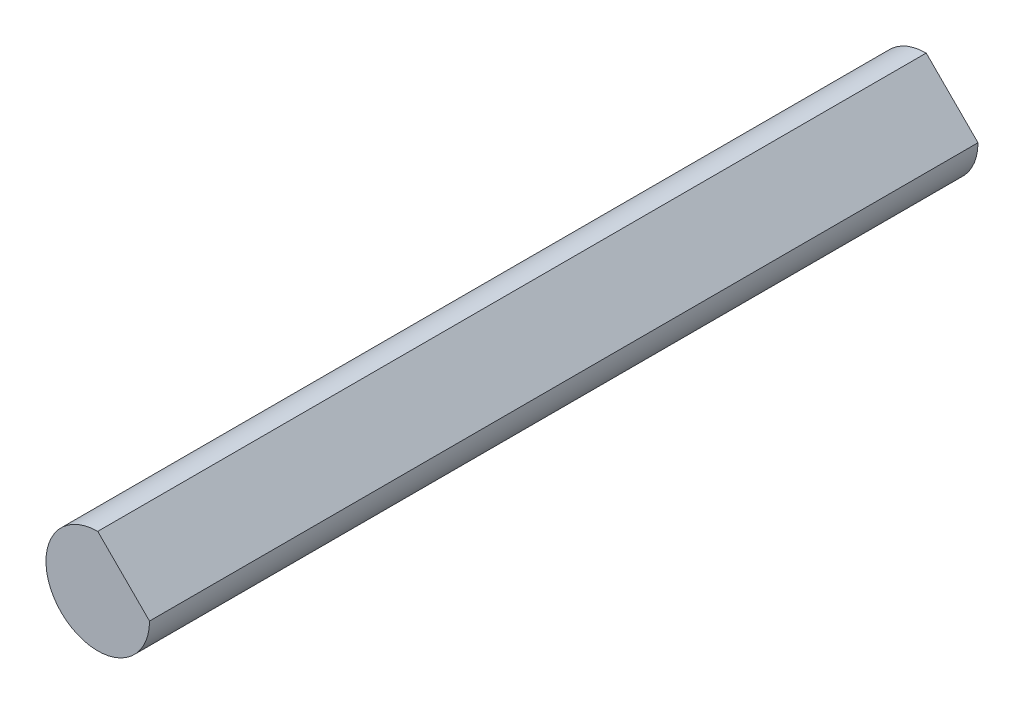
from build123d import *

# Parameters (mm, degrees)
SKETCH1_R           = 3.175
BOSS_EXTRUDE1_DEPTH = 50.8
CUT_EXTRUDE1_DEPTH  = 51.998051433


with BuildPart() as part:
    # Sketch1 → Boss-Extrude1 (new body)
    with BuildSketch(Plane.XY):
        Circle(SKETCH1_R)
    extrude(amount=BOSS_EXTRUDE1_DEPTH)

    # Sketch2 → Cut-Extrude1 (cut, through all)
    with BuildSketch(Plane.XY.offset(50.8)):
        with BuildLine():
            Line((0, 3.175), (3.175, 0))
            ThreePointArc((3.175, 0), (2.24506403, 2.24506403), (0, 3.175))
        make_face()
    extrude(amount=-CUT_EXTRUDE1_DEPTH, mode=Mode.SUBTRACT)


solid = part.part
